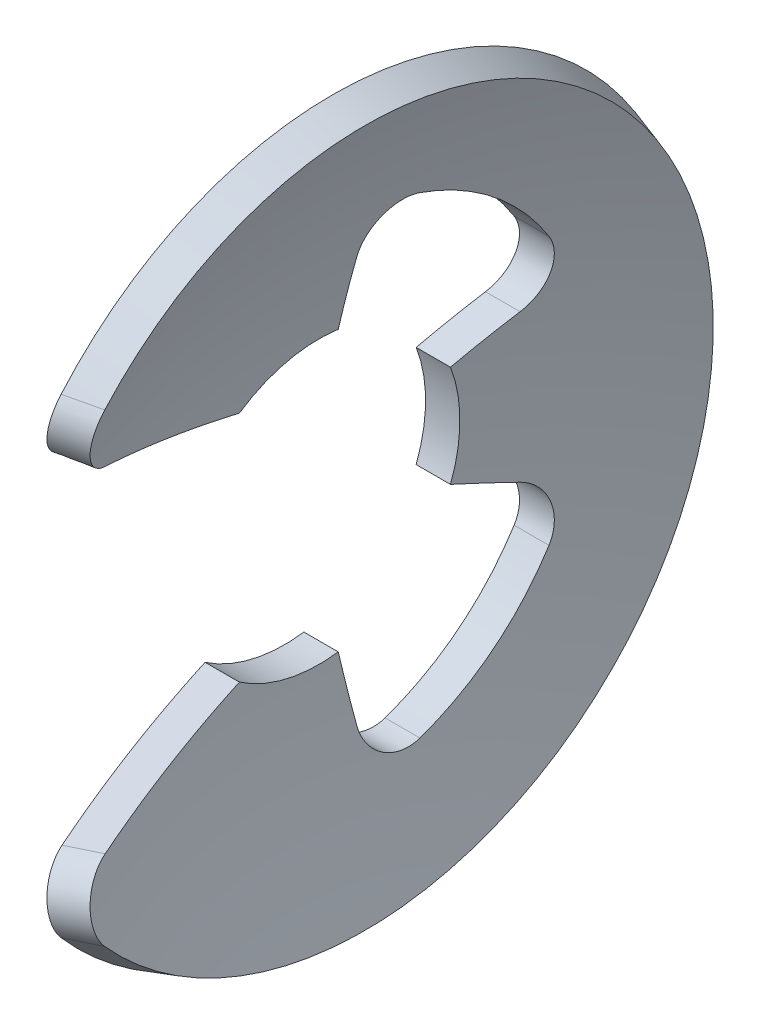
from build123d import *

# Parameters (mm, degrees)
CUT_EXTRUDE1_DEPTH = 10.608101884
FILLET1_R          = 0.762


with BuildPart() as part:
    # Sketch2 → Revolve1 (revolve)
    with BuildSketch(Plane(origin=(0, 0, 0), x_dir=(1, 0, 0), z_dir=(0, 1, 0)), mode=Mode.PRIVATE) as revolve1_sk:
        with BuildLine():
            Line((0.41129695, 6.6929), (1.016, 6.499097983))
            ThreePointArc((1.016, 6.499097983), (0.255533191, 3.289016973), (0, 0))
            Line((0, 0), (-0.635, 0))
            ThreePointArc((-0.635, 0), (-0.371846852, 3.38709491), (0.41129695, 6.6929))
        make_face()
    revolve(revolve1_sk.sketch.rotate(Axis((0, 0, 0), (1, 0, 0)), 180), axis=Axis((0, 0, 0), (1, 0, 0)))

    # Sketch1 → Cut-Extrude1 (cut, through all)
    with BuildSketch(Plane(origin=(1.016, 0, 0), x_dir=(0, 0, -1), z_dir=(1, 0, 0))):
        with BuildLine():
            Line((-5.711929949, -3.488375935), (-1.481934955, -2.171401391))
            ThreePointArc((-1.481934955, -2.171401391), (-0.600870128, -2.559310512), (0.360768614, -2.604027883))
            Line((0.360768614, -2.604027883), (0.639623582, -4.616803059))
            ThreePointArc((0.639623582, -4.616803059), (2.89470911, -3.653032709), (4.34839739, -1.677924))
            Line((4.34839739, -1.677924), (2.45263831, -0.946404))
            ThreePointArc((2.45263831, -0.946404), (2.6289, 0), (2.45263831, 0.946404))
            Line((2.45263831, 0.946404), (4.34839739, 1.677924))
            ThreePointArc((4.34839739, 1.677924), (2.89470911, 3.653032709), (0.639623582, 4.616803059))
            Line((0.639623582, 4.616803059), (0.360768614, 2.604027883))
            ThreePointArc((0.360768614, 2.604027883), (-0.600870128, 2.559310512), (-1.481934955, 2.171401391))
            Line((-1.481934955, 2.171401391), (-5.711929949, 3.488375935))
            ThreePointArc((-5.711929949, 3.488375935), (-6.6929, 0), (-5.711929949, -3.488375935))
        make_face()
    extrude(amount=-CUT_EXTRUDE1_DEPTH, mode=Mode.SUBTRACT)

    # Fillet1
    fillet1_edges = [part.edges().sort_by_distance(p)[0] for p in [
        (0.191190066, 4.616803059, -0.639623582),
        (0.191190066, 1.677924, -4.34839739),
        (0.191190066, -1.677924, -4.34839739),
        (0.191190066, -4.616803059, -0.639623582),
        (0.713662776, -3.458657833, 5.616478276),
        (0.713662776, 3.458657833, 5.616478276),
    ]]
    fillet(fillet1_edges, radius=FILLET1_R)


solid = part.part
